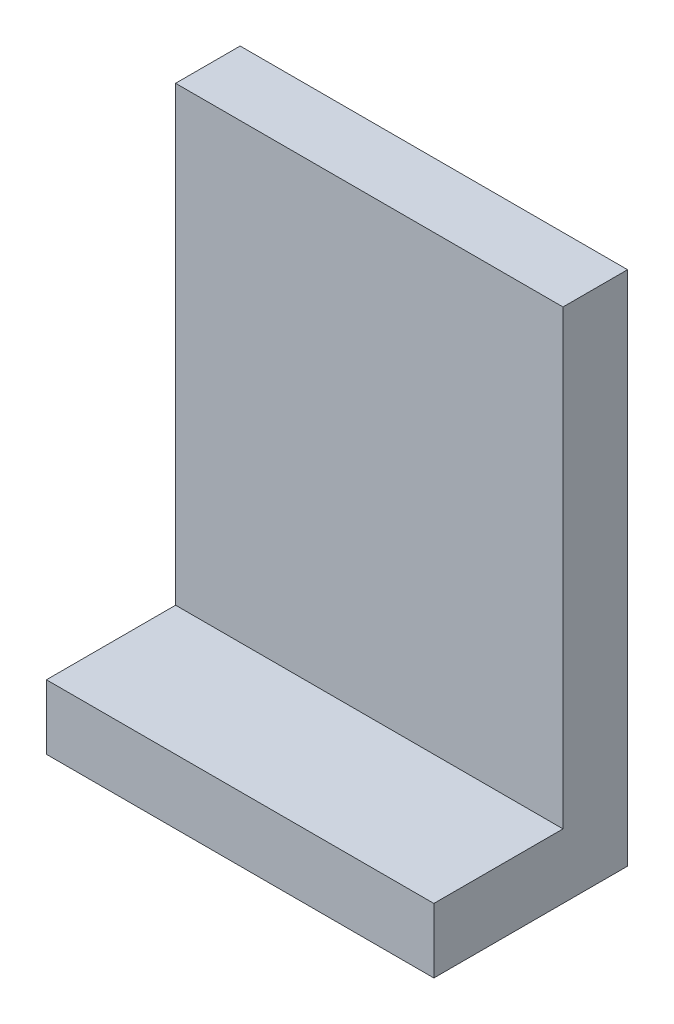
from build123d import *

# Parameters (mm, degrees)
ESQUISSE1_W        = 60
ESQUISSE1_H        = 20
ESQUISSE1_H_2      = 10
BOSS_EXTRU_1_DEPTH = 10
ESQUISSE2_W        = 60
ESQUISSE2_H        = 10
BOSS_EXTRU_2_DEPTH = 70


with BuildPart() as part:
    # Esquisse1 → Boss.-Extru.1 (new body)
    with BuildSketch(Plane(origin=(0, 0, 0), x_dir=(1, 0, 0), z_dir=(0, 1, 0))):
        with Locations((30, 10)):
            Rectangle(ESQUISSE1_W, ESQUISSE1_H)
        with Locations((30, 25)):
            Rectangle(ESQUISSE1_W, ESQUISSE1_H_2)
    extrude(amount=BOSS_EXTRU_1_DEPTH)

    # Esquisse2 → Boss.-Extru.2 (add)
    with BuildSketch(Plane(origin=(0, 10, 0), x_dir=(1, 0, 0), z_dir=(0, 1, 0))):
        with Locations((30, 25)):
            Rectangle(ESQUISSE2_W, ESQUISSE2_H)
    extrude(amount=BOSS_EXTRU_2_DEPTH)


solid = part.part
